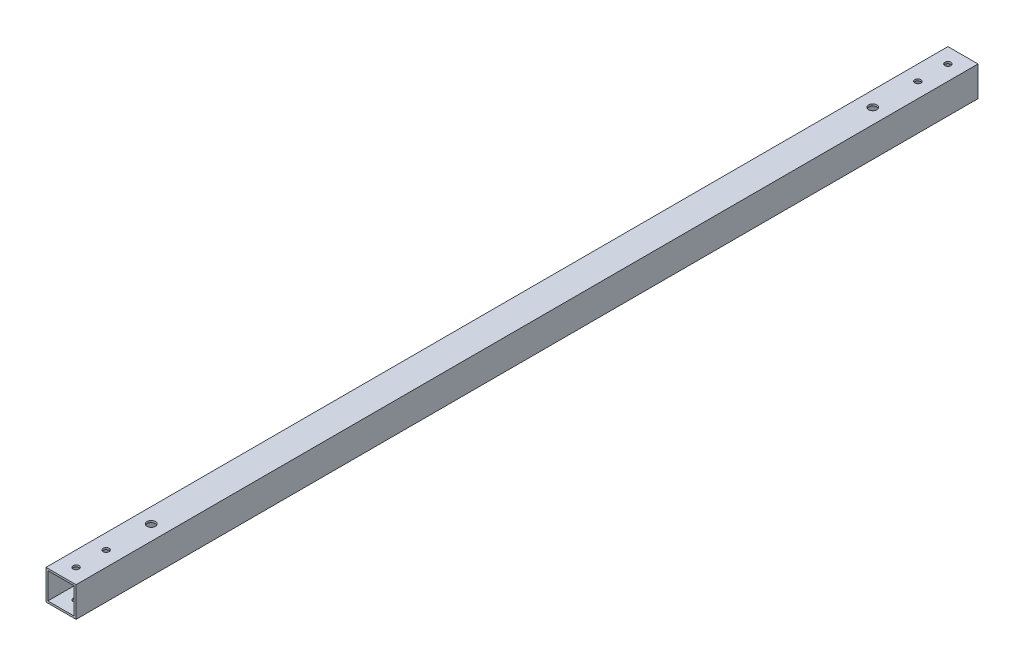
from build123d import *

# Parameters (mm, degrees)
SKETCH1_W           = 25.4
SKETCH1_H           = 25.4
SKETCH1_W_2         = 22.225
SKETCH1_H_2         = 22.225
BOSS_EXTRUDE1_DEPTH = 762
SKETCH3_R           = 2.54
SKETCH3_R_2         = 3.556
CUT_EXTRUDE2_DEPTH  = 763.846196818


with BuildPart() as part:
    # Sketch1 → Boss-Extrude1 (new body)
    with BuildSketch(Plane.XY):
        with Locations((12.7, 12.7)):
            Rectangle(SKETCH1_W, SKETCH1_H)
        with Locations((12.7, 12.7)):
            Rectangle(SKETCH1_W_2, SKETCH1_H_2, mode=Mode.SUBTRACT)
    extrude(amount=BOSS_EXTRUDE1_DEPTH)

    # Sketch3 → Cut-Extrude2 (cut, through all)
    with BuildSketch(Plane(origin=(0, 25.4, 0), x_dir=(1, 0, 0), z_dir=(0, 1, 0))):
        with Locations(Location((12.7, -12.7, 0), (0, 0, 270))):
            Circle(SKETCH3_R)
        with Locations(Location((12.7, -38.1, 0), (0, 0, 270))):
            Circle(SKETCH3_R)
        with Locations(Location((12.7, -76.2, 0), (0, 0, 270))):
            Circle(SKETCH3_R_2)
        with Locations(Location((12.7, -685.8, 0), (0, 0, 90))):
            Circle(SKETCH3_R_2)
        with Locations(Location((12.7, -723.9, 0), (0, 0, 90))):
            Circle(SKETCH3_R)
        with Locations(Location((12.7, -749.3, 0), (0, 0, 90))):
            Circle(SKETCH3_R)
    extrude(amount=-CUT_EXTRUDE2_DEPTH, mode=Mode.SUBTRACT)


solid = part.part
